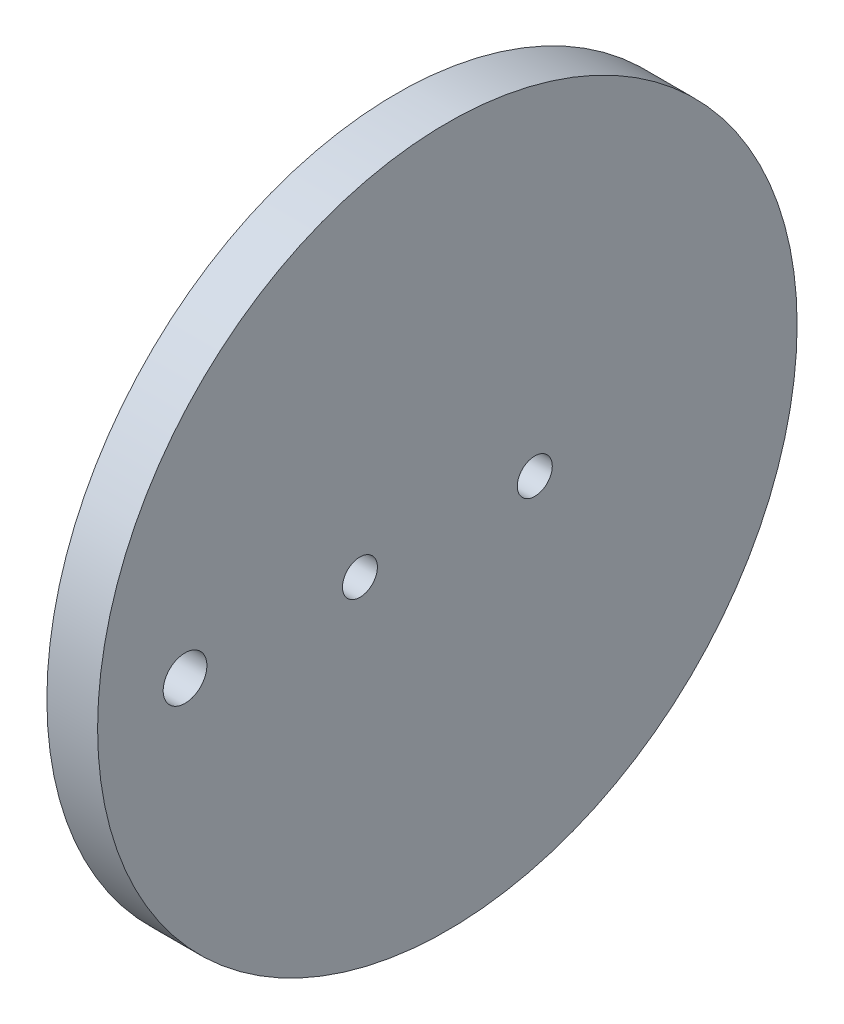
from build123d import *

# Parameters (mm, degrees)
SKETCH_1_R          = 40
EXTRUDE_1_DEPTH     = 5.8
SKETCH_2_R          = 2
SKETCH_2_R_2        = 2.5
CUT_EXTRUDE_1_DEPTH = 57.865103535


with BuildPart() as part:
    # ｽｹｯﾁ1 → ﾎﾞｽ - 押し出し1 (new body)
    with BuildSketch(Plane(origin=(0, 0, 0), x_dir=(0, 0, -1), z_dir=(1, 0, 0))):
        Circle(SKETCH_1_R)
    extrude(amount=EXTRUDE_1_DEPTH)

    # ｽｹｯﾁ2 → ｶｯﾄ - 押し出し1 (cut, through all)
    with BuildSketch(Plane(origin=(5.8, 0, 0), x_dir=(0, 0, -1), z_dir=(1, 0, 0))):
        with Locations((10, 0)):
            Circle(SKETCH_2_R)
        with Locations(Location((-10, 0, 0), (0, 0, 180))):
            Circle(SKETCH_2_R)
        with Locations((-30, 0)):
            Circle(SKETCH_2_R_2)
    extrude(amount=-CUT_EXTRUDE_1_DEPTH, mode=Mode.SUBTRACT)


solid = part.part
